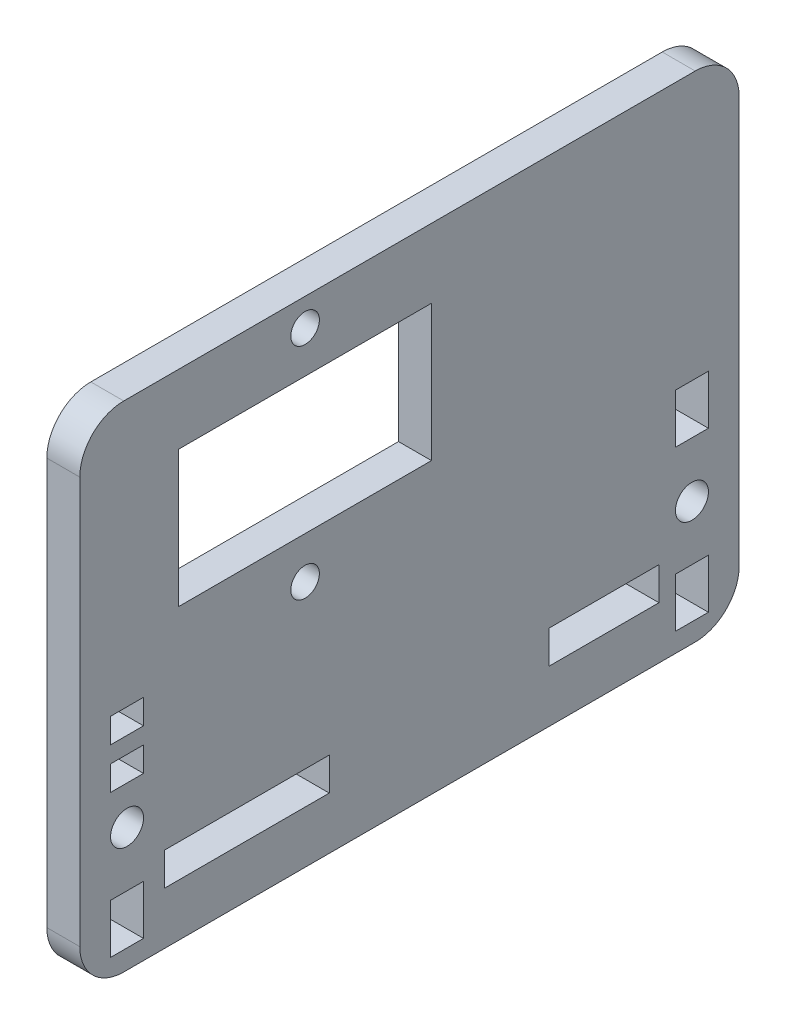
from build123d import *

# Parameters (mm, degrees)
ESBO_O1_W                    = 60
ESBO_O1_H                    = 45
RESSALTO_EXTRUS_O1_DEPTH     = 3
FURO_DE_DI_METRO_3_0_3_1_D   = 3
ESBO_O9_W                    = 3
ESBO_O9_H                    = 4.5
ESBO_O9_H_2                  = 2.25
CORTE_EXTRUS_O2_DEPTH        = 38.619808612
PERFIL_CORTE_W               = 23
PERFIL_CORTE_H               = 12.4
CORTE_PRINCIPAL_DEPTH        = 71.704257164
FURO_DE_DI_METRO_2_6_2_6_1_D = 2.6
FILETE1_R                    = 4
ESBO_O6_W                    = 15
ESBO_O6_H                    = 3
ESBO_O6_W_2                  = 10
CORTE_EXTRUS_O1_DEPTH        = 38.619808612


with BuildPart() as part:
    # Esboço1 → Ressalto-extrusão1 (new body)
    with BuildSketch(Plane(origin=(0, 0, 0), x_dir=(0, 0, -1), z_dir=(1, 0, 0))):
        Rectangle(ESBO_O1_W, ESBO_O1_H)
    extrude(amount=RESSALTO_EXTRUS_O1_DEPTH)

    # Furo de diâmetro Ø3.0 (3)1 (through all)
    with Locations(Plane(origin=(3, 0, 0), x_dir=(0, 0, -1), z_dir=(1, 0, 0))):
        with Locations((-25.7, -11.25), (25.7, -11.25)):
            Hole(FURO_DE_DI_METRO_3_0_3_1_D / 2)

    # Esboço9 → Corte-extrusão2 (cut, through all)
    with BuildSketch(Plane(origin=(0, 0, 0), x_dir=(0, 0, -1), z_dir=(1, 0, 0))):
        with Locations((-25.7, -18.5)):
            Rectangle(ESBO_O9_W, ESBO_O9_H)
        with Locations((-25.7, -2.875)):
            Rectangle(ESBO_O9_W, ESBO_O9_H_2)
        with Locations((-25.7, -6.625)):
            Rectangle(ESBO_O9_W, ESBO_O9_H_2)
        with Locations((25.7, -18.5)):
            Rectangle(ESBO_O9_W, ESBO_O9_H)
        with Locations((25.7, -4)):
            Rectangle(ESBO_O9_W, ESBO_O9_H)
    extrude(amount=CORTE_EXTRUS_O2_DEPTH, mode=Mode.SUBTRACT)

    # Perfil Corte → Corte Principal (cut, through all)
    with BuildSketch(Plane(origin=(3, -11.32307532, -32.016865102), x_dir=(0, 0, -1), z_dir=(1, 0, 0))):
        with Locations((-41.516865102, 21.32307532)):
            Rectangle(PERFIL_CORTE_W, PERFIL_CORTE_H)
    extrude(amount=-CORTE_PRINCIPAL_DEPTH, mode=Mode.SUBTRACT)

    # Furo de diâmetro Ø2.6 (2.6)1 (through all)
    with Locations(Plane(origin=(3, -5, 96.504216275), x_dir=(0, 0, -1), z_dir=(1, 0, 0))):
        with Locations((87.004216275, 25), (87.004216275, 5)):
            Hole(FURO_DE_DI_METRO_2_6_2_6_1_D / 2)

    # Filete1
    filete1_edges = [part.edges().sort_by_distance(p)[0] for p in [
        (1.5, 22.5, 30),
        (1.5, 22.5, -30),
        (1.5, -22.5, -30),
        (1.5, -22.5, 30),
    ]]
    fillet(filete1_edges, radius=FILETE1_R)

    # Esboço6 → Corte-extrusão1 (cut, through all)
    with BuildSketch(Plane(origin=(0, 0, 0), x_dir=(0, 0, -1), z_dir=(1, 0, 0))):
        with Locations((-14.8, -16.25)):
            Rectangle(ESBO_O6_W, ESBO_O6_H)
        with Locations((17.7, -16.25)):
            Rectangle(ESBO_O6_W_2, ESBO_O6_H)
    extrude(amount=CORTE_EXTRUS_O1_DEPTH, mode=Mode.SUBTRACT)


solid = part.part
